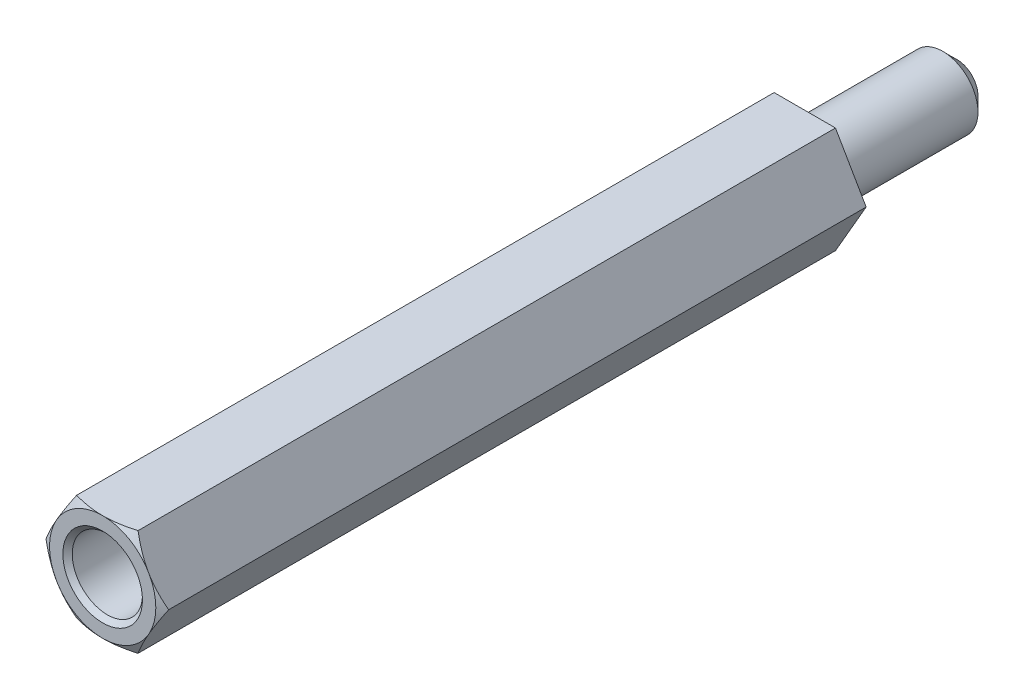
from build123d import *

# Parameters (mm, degrees)
BOSS_EXTRUDE1_DEPTH     = 30
CUT_EXTRUDE1_DEPTH      = 31.199725716
CUT_EXTRUDE1_DEPTH_BACK = 12
SKETCH2_R               = 1.5
CHAMFER1_SIZE           = 0.2
SKETCH4_R               = 1.5
BOSS_EXTRUDE2_DEPTH     = 6.5
CHAMFER2_SIZE           = 0.6


with BuildPart() as part:
    # Sketch1 → Boss-Extrude1 (new body)
    with BuildSketch(Plane.XY):
        Polygon((2.621170222, 0), (1.310585111, 2.27), (-1.310585111, 2.27), (-2.621170222, 0), (-1.310585111, -2.27), (1.310585111, -2.27), align=None)
    extrude(amount=BOSS_EXTRUDE1_DEPTH)

    # Sketch2 → Cut-Extrude1 (cut, two sides: drawn at the far end of the back side and taken through both)
    with BuildSketch(Plane.XY.offset(30).offset(-CUT_EXTRUDE1_DEPTH_BACK)):
        with Locations(Location((0, 0, 0), (0, 0, 180))):
            Circle(SKETCH2_R)
    extrude(amount=CUT_EXTRUDE1_DEPTH + CUT_EXTRUDE1_DEPTH_BACK, mode=Mode.SUBTRACT)

    # Sketch3 → Cut-Revolve1 (revolve, cut)
    with BuildSketch(Plane(origin=(0, 0, 0), x_dir=(1, 0, 0), z_dir=(0, 1, 0))):
        Polygon((-2.621170222, -30), (-2.271170222, -30), (-2.621170222, -29.8), align=None)
    revolve(axis=Axis((0, 0, 18), (0, 0, 1)), mode=Mode.SUBTRACT)

    # Chamfer1
    chamfer1_edges = [part.edges().sort_by_distance(p)[0] for p in [
        (1.5, 0, 30),
    ]]
    chamfer(chamfer1_edges, length=CHAMFER1_SIZE)

    # Sketch4 → Boss-Extrude2 (add)
    with BuildSketch(Plane(origin=(0, 0, 0), x_dir=(-1, 0, 0), z_dir=(0, 0, -1))):
        Circle(SKETCH4_R)
    extrude(amount=BOSS_EXTRUDE2_DEPTH)

    # Chamfer2
    chamfer2_edges = [part.edges().sort_by_distance(p)[0] for p in [
        (1.5, 0, -6.5),
    ]]
    chamfer(chamfer2_edges, length=CHAMFER2_SIZE)


solid = part.part
